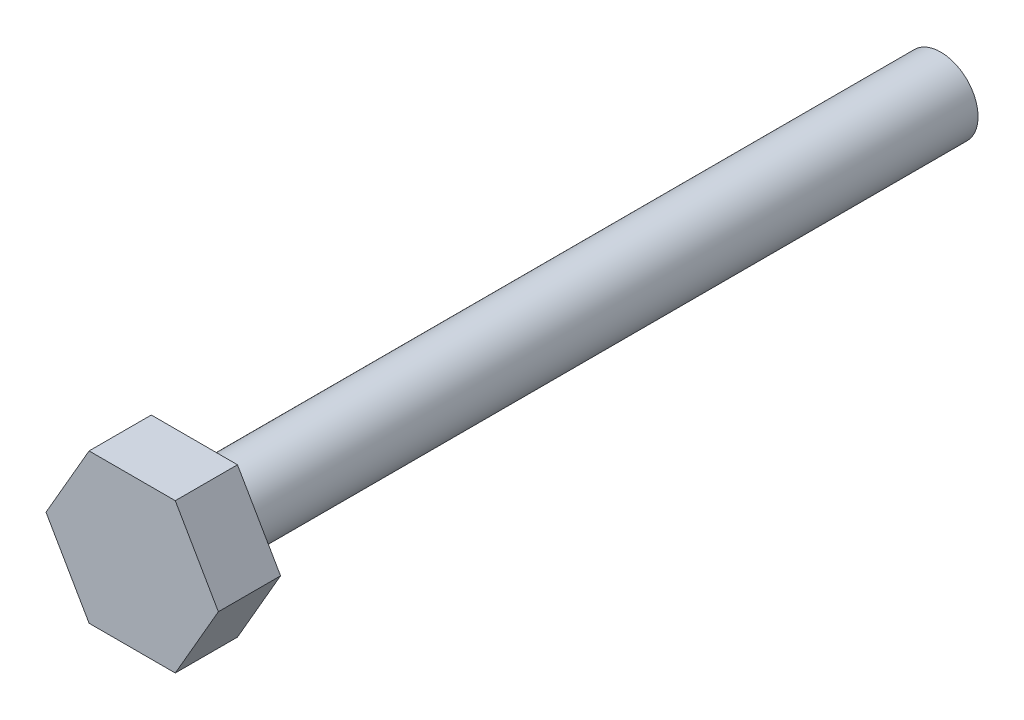
from build123d import *

# Parameters (mm, degrees)
BOSS_EXTRUDE1_DEPTH = 5
SKETCH2_R           = 3
BOSS_EXTRUDE2_DEPTH = 60


with BuildPart() as part:
    # Sketch1 → Boss-Extrude1 (new body)
    with BuildSketch(Plane.XY):
        Polygon((3.464101615, 6), (-3.464101615, 6), (-6.92820323, 0), (-3.464101615, -6), (3.464101615, -6), (6.92820323, 0), align=None)
    extrude(amount=BOSS_EXTRUDE1_DEPTH)

    # Sketch2 → Boss-Extrude2 (add)
    with BuildSketch(Plane(origin=(0, 0, 0), x_dir=(-1, 0, 0), z_dir=(0, 0, -1))):
        Circle(SKETCH2_R)
    extrude(amount=BOSS_EXTRUDE2_DEPTH)


solid = part.part
